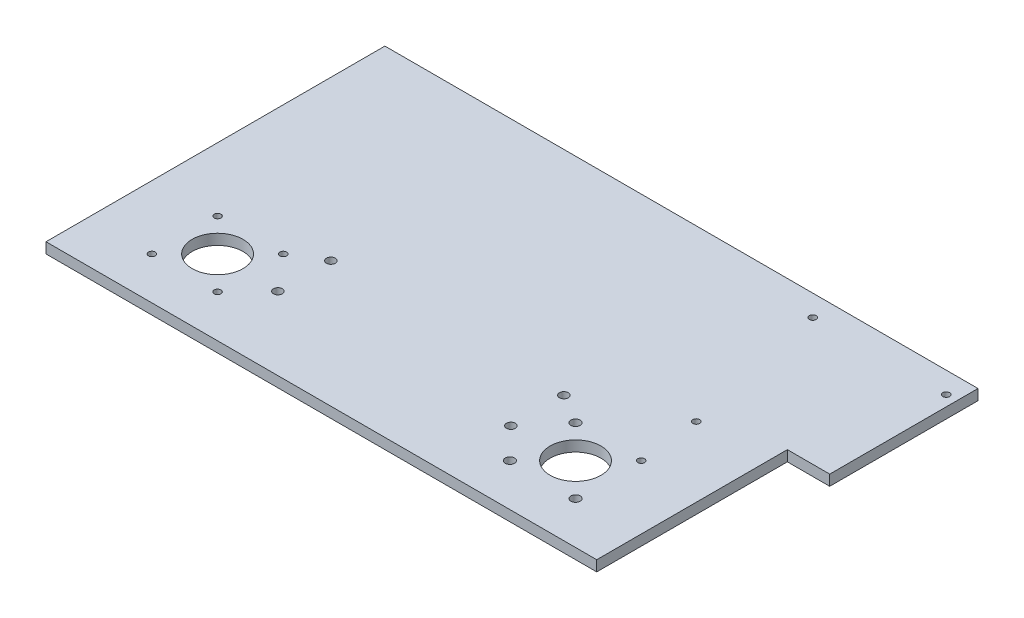
from build123d import *

# Parameters (mm, degrees)
SKETCH_1_R      = 1.6
SKETCH_1_R_2    = 12
SKETCH_1_R_3    = 2.1
SKETCH_1_R_4    = 2.2
EXTRUDE_1_DEPTH = 5


with BuildPart() as part:
    # 草图1 → 凸台-拉伸1 (new body)
    with BuildSketch(Plane(origin=(0, 0, 0), x_dir=(1, 0, 0), z_dir=(0, 1, 0))):
        Polygon((-140, 80), (-140, -80), (120, -80), (120, 10), (140, 10), (140, 80), align=None)
        with Locations(Location((-110, -60, 0), (0, 0, 270))):
            Circle(SKETCH_1_R, mode=Mode.SUBTRACT)
        with Locations(Location((-79, -60, 0), (0, 0, 270))):
            Circle(SKETCH_1_R, mode=Mode.SUBTRACT)
        with Locations(Location((-94.5, -44.5, 0), (0, 0, 270))):
            Circle(SKETCH_1_R_2, mode=Mode.SUBTRACT)
        with Locations(Location((-65, -45.5, 0), (0, 0, 270))):
            Circle(SKETCH_1_R_3, mode=Mode.SUBTRACT)
        with Locations(Location((-110, -29, 0), (0, 0, 270))):
            Circle(SKETCH_1_R, mode=Mode.SUBTRACT)
        with Locations(Location((-79, -29, 0), (0, 0, 270))):
            Circle(SKETCH_1_R, mode=Mode.SUBTRACT)
        with Locations(Location((-65, -20.5, 0), (0, 0, 270))):
            Circle(SKETCH_1_R_3, mode=Mode.SUBTRACT)
        with Locations(Location((59, -60, 0), (0, 0, 270))):
            Circle(SKETCH_1_R_4, mode=Mode.SUBTRACT)
        with Locations(Location((45, -45.5, 0), (0, 0, 270))):
            Circle(SKETCH_1_R_3, mode=Mode.SUBTRACT)
        with Locations(Location((90, -60, 0), (0, 0, 270))):
            Circle(SKETCH_1_R_4, mode=Mode.SUBTRACT)
        with Locations(Location((74.5, -44.5, 0), (0, 0, 270))):
            Circle(SKETCH_1_R_2, mode=Mode.SUBTRACT)
        with Locations(Location((45, -20.5, 0), (0, 0, 270))):
            Circle(SKETCH_1_R_3, mode=Mode.SUBTRACT)
        with Locations(Location((59, -29, 0), (0, 0, 270))):
            Circle(SKETCH_1_R_4, mode=Mode.SUBTRACT)
        with Locations(Location((90, -29, 0), (0, 0, 270))):
            Circle(SKETCH_1_R, mode=Mode.SUBTRACT)
        with Locations(Location((87, 0, 0), (0, 0, 270))):
            Circle(SKETCH_1_R, mode=Mode.SUBTRACT)
        with Locations(Location((72, 70, 0), (0, 0, 270))):
            Circle(SKETCH_1_R, mode=Mode.SUBTRACT)
        with Locations(Location((135, 70, 0), (0, 0, 270))):
            Circle(SKETCH_1_R, mode=Mode.SUBTRACT)
    extrude(amount=EXTRUDE_1_DEPTH)


solid = part.part
